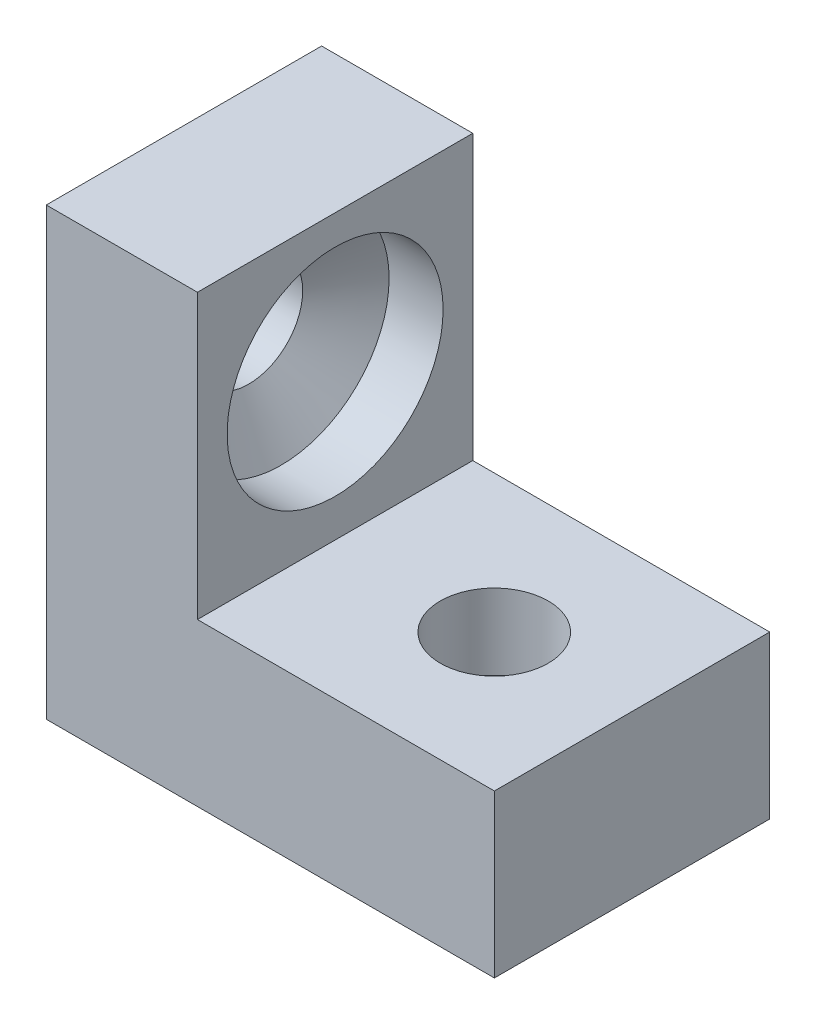
from build123d import *

# Parameters (mm, degrees)
ESQUISSE1_W        = 8.3
ESQUISSE1_H        = 5.1
BOSS_EXTRU_1_DEPTH = 3
ESQUISSE2_W        = 2.8
ESQUISSE2_H        = 5.1
BOSS_EXTRU_2_DEPTH = 5.25


with BuildPart() as part:
    # Esquisse1 → Boss.-Extru.1 (new body)
    with BuildSketch(Plane(origin=(0, 0, 0), x_dir=(1, 0, 0), z_dir=(0, 1, 0))):
        with Locations((4.15, 2.55)):
            Rectangle(ESQUISSE1_W, ESQUISSE1_H)
    extrude(amount=BOSS_EXTRU_1_DEPTH)

    # Esquisse2 → Boss.-Extru.2 (add)
    with BuildSketch(Plane(origin=(0, 3, 0), x_dir=(1, 0, 0), z_dir=(0, 1, 0))):
        with Locations((1.4, 2.55)):
            Rectangle(ESQUISSE2_W, ESQUISSE2_H)
    extrude(amount=BOSS_EXTRU_2_DEPTH)

    # Esquisse6 → Perçage1 (revolve, cut)
    with BuildSketch(Plane(origin=(2.8, 5.7, -2.55), x_dir=(0, 0, -1), z_dir=(0, 1, 0))):
        Polygon((0, 0), (0, 3.400860619), (1, 2.8), (1, 1.600860619), (2, 1), (2, 0), align=None)
    revolve(axis=Axis((8.930023899, 5.7, -2.55), (-1, 0, 0)), mode=Mode.SUBTRACT)

    # Esquisse9 → Perçage2 (revolve, cut)
    with BuildSketch(Plane(origin=(5.750237397, 0, -2.547317036), x_dir=(0, 0, -1), z_dir=(1, 0, 0))):
        Polygon((0, 0), (0, 10.600860619), (1, 10), (1, 1.600860619), (2, 1), (2, 0), align=None)
    revolve(axis=Axis((5.750237397, -6.130023899, -2.547317036), (0, 1, 0)), mode=Mode.SUBTRACT)


solid = part.part
